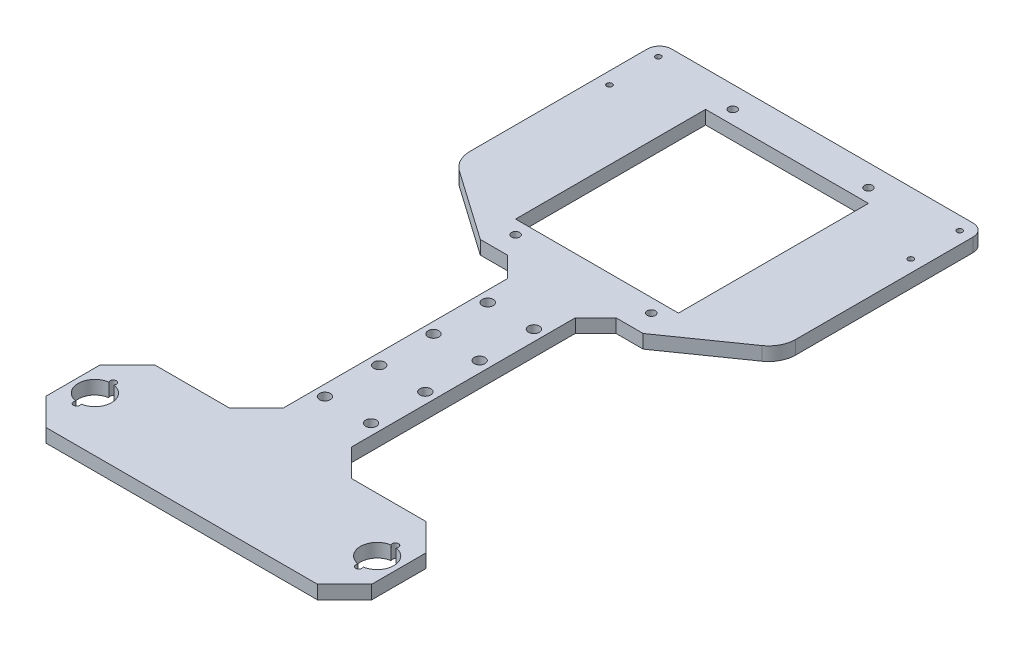
from build123d import *

# Parameters (mm, degrees)
BASE_DEPTH               = 5
ESBO_O2_R                = 1
FURO_BRACKET_MOTOR_DEPTH = 3
ESBO_O4_W                = 60
ESBO_O4_H                = 70
ENCAIXE_PCB_DEPTH        = 236.334523507
ESBO_O6_R                = 1.5
PARAFUSO_PCB_DEPTH       = 236.334523507
ESBO_O7_R                = 2
ENFORCA_GATO_DEPTH       = 236.334523507
CORTE_EXTRUS_O1_DEPTH    = 10


with BuildPart() as part:
    # Esboço1 → Base (new body)
    with BuildSketch(Plane(origin=(0, 0, 0), x_dir=(1, 0, 0), z_dir=(0, 1, 0))):
        with BuildLine():
            Line((-18.088885989, 17.941465294), (-18.088885989, 19.441465294))
            ThreePointArc((-18.088885989, 19.441465294), (-16.770866504, 22.623445809), (-13.588885989, 23.941465294))
            Line((-13.588885989, 23.941465294), (97.411114011, 23.941465294))
            ThreePointArc((97.411114011, 23.941465294), (100.593094526, 22.623445809), (101.911114011, 19.441465294))
            Line((101.911114011, 19.441465294), (101.911114011, 17.941465294))
            Line((101.911114011, 17.941465294), (101.911114011, -45.8528642))
            ThreePointArc((101.911114011, -45.8528642), (100.781222343, -50.470350333), (97.646878374, -54.044384643))
            Line((97.646878374, -54.044384643), (71.911114011, -72.064760852))
            Line((71.911114011, -72.064760852), (61.911114011, -72.064760852))
            Line((61.911114011, -72.064760852), (54.411114011, -79.564760852))
            Line((54.411114011, -79.564760852), (54.411114011, -162.064760852))
            Line((54.411114011, -162.064760852), (64.411114011, -172.064760852))
            Line((64.411114011, -172.064760852), (91.911114011, -172.064760852))
            Line((91.911114011, -172.064760852), (101.911114011, -182.064760852))
            Line((101.911114011, -182.064760852), (101.911114011, -202.064760852))
            Line((101.911114011, -202.064760852), (91.911114011, -212.064760852))
            Line((91.911114011, -212.064760852), (-8.088885989, -212.064760852))
            Line((-8.088885989, -212.064760852), (-18.088885989, -202.064760852))
            Line((-18.088885989, -202.064760852), (-18.088885989, -182.064760852))
            Line((-18.088885989, -182.064760852), (-8.088885989, -172.064760852))
            Line((-8.088885989, -172.064760852), (19.411114011, -172.064760852))
            Line((19.411114011, -172.064760852), (29.411114011, -162.064760852))
            Line((29.411114011, -162.064760852), (29.411114011, -79.564760852))
            Line((29.411114011, -79.564760852), (21.911114011, -72.064760852))
            Line((21.911114011, -72.064760852), (11.911114011, -72.064760852))
            Line((11.911114011, -72.064760852), (-13.824650353, -54.044384643))
            ThreePointArc((-13.824650353, -54.044384643), (-16.958994321, -50.470350333), (-18.088885989, -45.8528642))
            Line((-18.088885989, -45.8528642), (-18.088885989, 17.941465294))
        make_face()
    extrude(amount=BASE_DEPTH)

    # Esboço2 → Furo Bracket Motor (cut)
    with BuildSketch(Plane(origin=(0, 5, 0), x_dir=(1, 0, 0), z_dir=(0, 1, 0))):
        with Locations(Location((-13.588885989, 19.021465294, 0), (0, 0, 270))):
            Circle(ESBO_O2_R)
        with Locations(Location((-13.588885989, 1.021465294, 0), (0, 0, 270))):
            Circle(ESBO_O2_R)
        with Locations(Location((97.411114011, 1.021465294, 0), (0, 0, 90))):
            Circle(ESBO_O2_R)
        with Locations(Location((97.411114011, 19.021465294, 0), (0, 0, 90))):
            Circle(ESBO_O2_R)
    extrude(amount=-FURO_BRACKET_MOTOR_DEPTH, mode=Mode.SUBTRACT)

    # Esboço4 → Encaixe PCB (cut, through all)
    with BuildSketch(Plane.XZ):
        with Locations((41.911114011, 24.063534706)):
            Rectangle(ESBO_O4_W, ESBO_O4_H)
    extrude(amount=-ENCAIXE_PCB_DEPTH, mode=Mode.SUBTRACT)

    # Esboço6 → Parafuso PCB (cut, through all)
    with BuildSketch(Plane.XZ):
        with Locations(Location((16.911114011, 64.063534706, 0), (0, 0, 270))):
            Circle(ESBO_O6_R)
        with Locations(Location((66.911114011, 64.063534706, 0), (0, 0, 270))):
            Circle(ESBO_O6_R)
        with Locations(Location((66.911114011, -15.936465294, 0), (0, 0, 270))):
            Circle(ESBO_O6_R)
        with Locations(Location((16.911114011, -15.936465294, 0), (0, 0, 270))):
            Circle(ESBO_O6_R)
    extrude(amount=-PARAFUSO_PCB_DEPTH, mode=Mode.SUBTRACT)

    # Esboço7 → Enforca Gato (cut, through all)
    with BuildSketch(Plane.XZ):
        with Locations(Location((33.411114011, 90.814760852, 0), (0, 0, 270))):
            Circle(ESBO_O7_R)
        with Locations(Location((33.411114011, 110.814760852, 0), (0, 0, 270))):
            Circle(ESBO_O7_R)
        with Locations(Location((33.411114011, 130.814760852, 0), (0, 0, 270))):
            Circle(ESBO_O7_R)
        with Locations(Location((33.411114011, 150.814760852, 0), (0, 0, 270))):
            Circle(ESBO_O7_R)
        with Locations(Location((50.411114011, 150.814760852, 0), (0, 0, 90))):
            Circle(ESBO_O7_R)
        with Locations(Location((50.411114011, 130.814760852, 0), (0, 0, 90))):
            Circle(ESBO_O7_R)
        with Locations(Location((50.411114011, 110.814760852, 0), (0, 0, 90))):
            Circle(ESBO_O7_R)
        with Locations(Location((50.411114011, 90.814760852, 0), (0, 0, 90))):
            Circle(ESBO_O7_R)
    extrude(amount=-ENFORCA_GATO_DEPTH, mode=Mode.SUBTRACT)

    # Esboço8 → Corte-extrusão1 (cut)
    with BuildSketch(Plane.XZ):
        with BuildLine():
            ThreePointArc((-11.029836312, 185.987169842), (-10.088885989, 184.189760852), (-9.147935666, 185.987169842))
            ThreePointArc((-9.147935666, 185.987169842), (-3.938885989, 192.064760852), (-9.147935666, 198.142351863))
            ThreePointArc((-9.147935666, 198.142351863), (-10.088885989, 199.939760852), (-11.029836312, 198.142351863))
            ThreePointArc((-11.029836312, 198.142351863), (-16.238885989, 192.064760852), (-11.029836312, 185.987169842))
        make_face()
        with BuildLine():
            ThreePointArc((92.970163688, 185.987169842), (87.761114011, 192.064760852), (92.970163688, 198.142351863))
            ThreePointArc((92.970163688, 198.142351863), (93.911114011, 199.939760852), (94.852064334, 198.142351863))
            ThreePointArc((94.852064334, 198.142351863), (100.061114011, 192.064760852), (94.852064334, 185.987169842))
            ThreePointArc((94.852064334, 185.987169842), (93.911114011, 184.189760852), (92.970163688, 185.987169842))
        make_face()
    extrude(amount=-CORTE_EXTRUS_O1_DEPTH, mode=Mode.SUBTRACT)


solid = part.part
